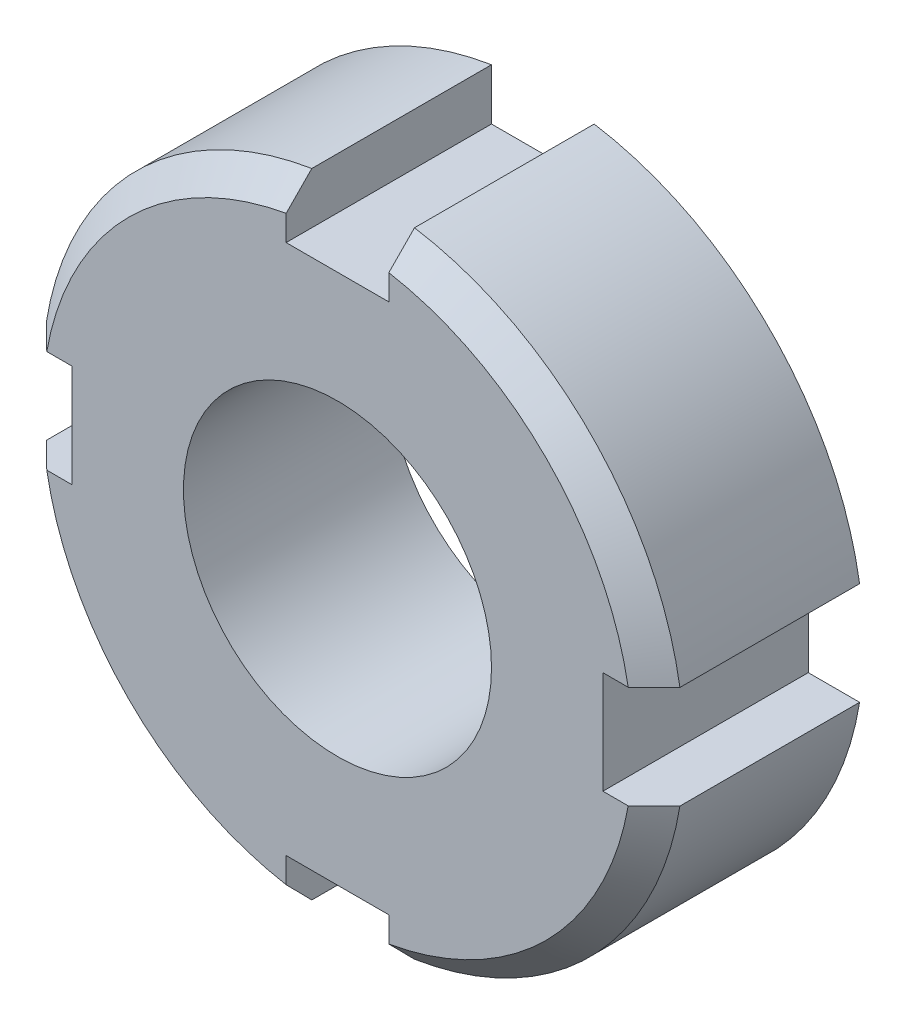
from build123d import *

# Parameters (mm, degrees)
SKETCH1_R           = 12.5
BOSS_EXTRUDE1_DEPTH = 8
CUT_EXTRUDE1_DEPTH  = 20.403607912
SKETCH3_R           = 6
CUT_EXTRUDE2_DEPTH  = 20.19635382
CHAMFER1_SIZE       = 1


with BuildPart() as part:
    # Sketch1 → Boss-Extrude1 (new body)
    with BuildSketch(Plane.XY):
        Circle(SKETCH1_R)
    extrude(amount=BOSS_EXTRUDE1_DEPTH)

    # Sketch2 → Cut-Extrude1 (cut, through all)
    with BuildSketch(Plane.XY.offset(8)):
        with BuildLine():
            Line((-2, 12.338962679), (-2, 10.338962679))
            Line((-2, 10.338962679), (2, 10.338962679))
            Line((2, 10.338962679), (2, 12.338962679))
            ThreePointArc((2, 12.338962679), (0, 12.5), (-2, 12.338962679))
        make_face()
        with BuildLine():
            Line((12.338962679, 2), (10.338962679, 2))
            Line((10.338962679, 2), (10.338962679, -2))
            Line((10.338962679, -2), (12.338962679, -2))
            ThreePointArc((12.338962679, -2), (12.5, 0), (12.338962679, 2))
        make_face()
        with BuildLine():
            Line((2, -12.338962679), (2, -10.338962679))
            Line((2, -10.338962679), (-2, -10.338962679))
            Line((-2, -10.338962679), (-2, -12.338962679))
            ThreePointArc((-2, -12.338962679), (0, -12.5), (2, -12.338962679))
        make_face()
        with BuildLine():
            Line((-12.338962679, -2), (-10.338962679, -2))
            Line((-10.338962679, -2), (-10.338962679, 2))
            Line((-10.338962679, 2), (-12.338962679, 2))
            ThreePointArc((-12.338962679, 2), (-12.5, 0), (-12.338962679, -2))
        make_face()
    extrude(amount=-CUT_EXTRUDE1_DEPTH, mode=Mode.SUBTRACT)

    # Sketch3 → Cut-Extrude2 (cut, through all)
    with BuildSketch(Plane.XY.offset(8)):
        Circle(SKETCH3_R)
    extrude(amount=-CUT_EXTRUDE2_DEPTH, mode=Mode.SUBTRACT)

    # Chamfer1
    chamfer1_edges = [part.edges().sort_by_distance(p)[0] for p in [
        (-8.838834765, 8.838834765, 8),
        (-8.838834765, -8.838834765, 8),
        (8.838834765, -8.838834765, 8),
        (8.838834765, 8.838834765, 8),
    ]]
    chamfer(chamfer1_edges, length=CHAMFER1_SIZE)


solid = part.part
